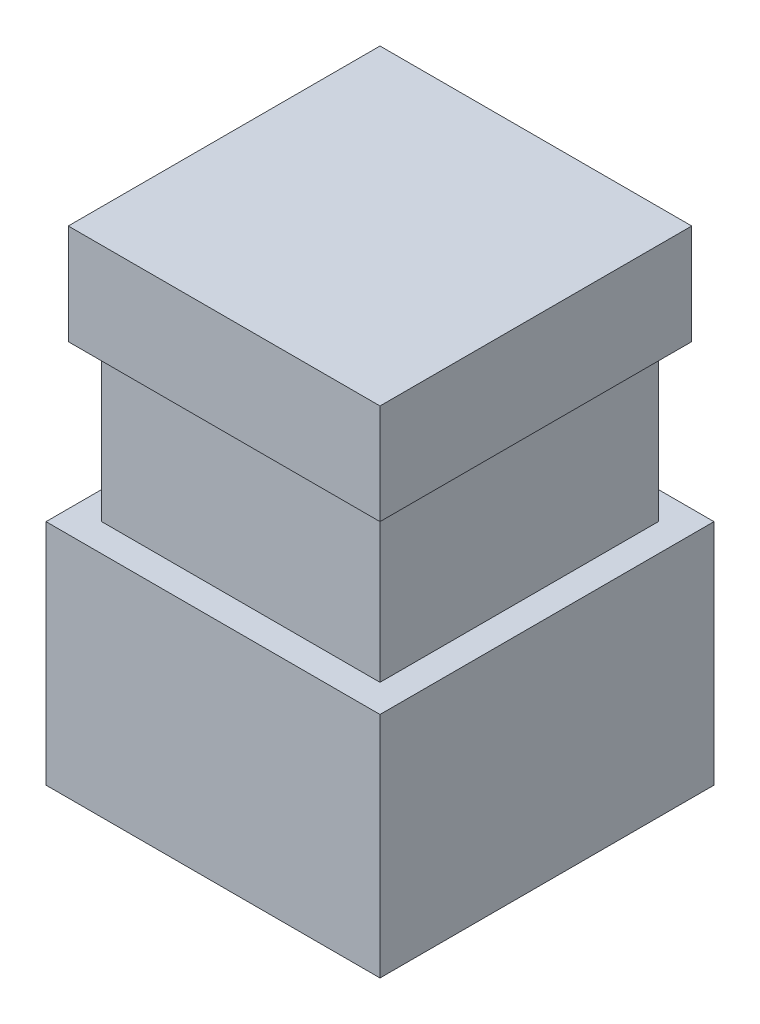
from build123d import *

# Parameters (mm, degrees)
SKETCH1_W                = 60
SKETCH1_H                = 60
BOSS_EXTRUDE1_DEPTH      = 41
M3_CLEARANCE_HOLE1_D     = 3.4
M3_CLEARANCE_HOLE1_DEPTH = 7
M3_CLEARANCE_HOLE1_TIP   = 1.021463052
SKETCH4_W                = 50
SKETCH4_H                = 50
BOSS_EXTRUDE2_DEPTH      = 28
SKETCH5_W                = 56
SKETCH5_H                = 56
BOSS_EXTRUDE3_DEPTH      = 18


with BuildPart() as part:
    # Sketch1 → Boss-Extrude1 (new body)
    with BuildSketch(Plane(origin=(0, 0, 0), x_dir=(1, 0, 0), z_dir=(0, 1, 0))):
        with Locations((30, 30)):
            Rectangle(SKETCH1_W, SKETCH1_H)
    extrude(amount=BOSS_EXTRUDE1_DEPTH)

    # M3 Clearance Hole1
    with Locations(Plane(origin=(0, 0, 0), x_dir=(-1, 0, 0), z_dir=(0, -1, 0))):
        with Locations((-3.5, 3.5), (-56.5, 3.5), (-56.5, 56.5), (-3.5, 56.5)):
            Hole(M3_CLEARANCE_HOLE1_D / 2, depth=M3_CLEARANCE_HOLE1_DEPTH)
            with Locations((0, 0, -(M3_CLEARANCE_HOLE1_DEPTH + M3_CLEARANCE_HOLE1_TIP / 2))):  # 118° drill point
                Cone(0, M3_CLEARANCE_HOLE1_D / 2, M3_CLEARANCE_HOLE1_TIP, mode=Mode.SUBTRACT)

    # Sketch4 → Boss-Extrude2 (add)
    with BuildSketch(Plane(origin=(0, 41, 0), x_dir=(1, 0, 0), z_dir=(0, 1, 0))):
        with Locations((30, 30)):
            Rectangle(SKETCH4_W, SKETCH4_H)
    extrude(amount=BOSS_EXTRUDE2_DEPTH)

    # Sketch5 → Boss-Extrude3 (add)
    with BuildSketch(Plane(origin=(0, 69, 0), x_dir=(1, 0, 0), z_dir=(0, 1, 0))):
        with Locations((30, 30)):
            Rectangle(SKETCH5_W, SKETCH5_H)
    extrude(amount=BOSS_EXTRUDE3_DEPTH)


solid = part.part
